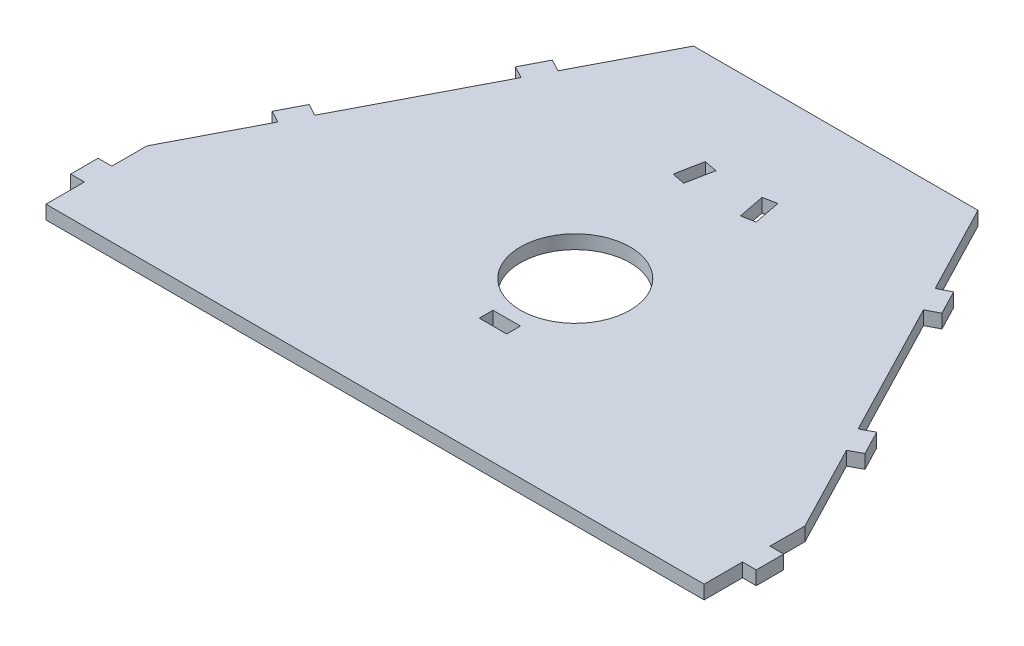
from build123d import *

# Parameters (mm, degrees)
BOSS_EXTRUDE1_DEPTH = 5
SKETCH2_W           = 5
SKETCH2_H           = 14
SKETCH2_W_2         = 10
SKETCH2_H_2         = 5
SKETCH2_R           = 20
CUT_EXTRUDE1_DEPTH  = 210.418973113


with BuildPart() as part:
    # Sketch1 → Boss-Extrude1 (new body)
    with BuildSketch(Plane(origin=(0, 0, 0), x_dir=(1, 0, 0), z_dir=(0, 1, 0))):
        Polygon((-57.5, 167.947331922), (57.5, 167.947331922), (125, 37.947331922), (125, -0.052668078), (-125, -0.052668078), (-125, 37.947331922), align=None)
    extrude(amount=BOSS_EXTRUDE1_DEPTH)

    # Sketch2 → Cut-Extrude1 (cut, through all)
    with BuildSketch(Plane(origin=(0, 5, 0), x_dir=(1, 0, 0), z_dir=(0, 1, 0))):
        Polygon((-77.788864465, 128.872481842), (-103.476511391, 79.39997665), (-99.075067661, 77.027785029), (-73.843707474, 125.621215804), (-73.351788432, 126.56861544), align=None)
        Polygon((-125, 37.947331922), (-125, 23.947331922), (-120, 23.947331922), (-120, 36.728164098), (-103.683242772, 68.152835894), (-108.083917213, 70.526454327), align=None)
        with Locations((-122.5, 6.947331922)):
            Rectangle(SKETCH2_W, SKETCH2_H)
        with Locations((0, 45.447331922)):
            Rectangle(SKETCH2_W_2, SKETCH2_H_2)
        Polygon((-8.411070301, 132.656760174), (-13.226399097, 133.599762064), (-15.148227411, 123.786170675), (-10.332898614, 122.843168786), align=None)
        Polygon((10.332898614, 122.843168786), (15.148227411, 123.786170675), (13.226399097, 133.599762064), (8.411070301, 132.656760174), align=None)
        Polygon((-73.180711758, 137.74744261), (-68.74270223, 135.443091446), (-51.865499988, 167.947331922), (-57.5, 167.947331922), align=None)
        Polygon((73.351788432, 126.56861544), (73.843707474, 125.621215804), (99.075067661, 77.027785029), (103.476511391, 79.39997665), (77.788864465, 128.872481842), align=None)
        Polygon((68.74270223, 135.443091446), (73.180711758, 137.74744261), (57.5, 167.947331922), (51.865499988, 167.947331922), align=None)
        with Locations((122.5, 6.947331922)):
            Rectangle(SKETCH2_W, SKETCH2_H)
        Polygon((125, 23.947331922), (125, 37.947331922), (108.083917213, 70.526454327), (103.683242772, 68.152835894), (120, 36.728164098), (120, 23.947331922), align=None)
        with Locations(Location((0, 72.947331922, 0), (0, 0, 270))):
            Circle(SKETCH2_R)
    extrude(amount=-CUT_EXTRUDE1_DEPTH, mode=Mode.SUBTRACT)


solid = part.part
